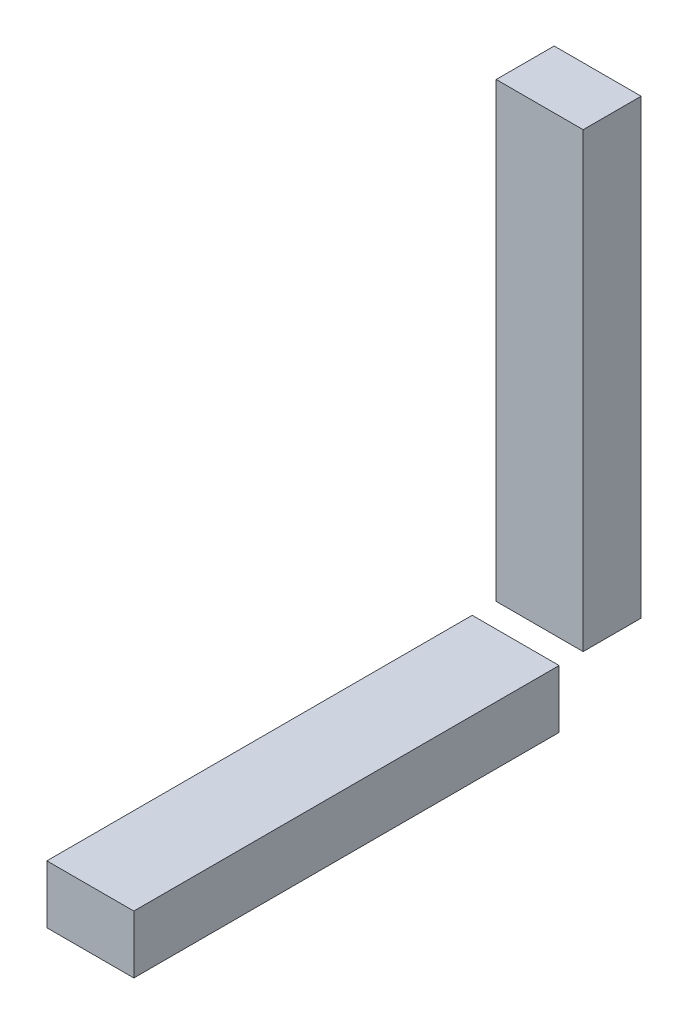
from build123d import *

# Parameters (mm, degrees)
SKETCH11_W          = 30
SKETCH11_H          = 155.928336779
BOSS_EXTRUDE2_DEPTH = 20
SKETCH16_W          = 146.715728753
SKETCH16_H          = 20
BOSS_EXTRUDE3_DEPTH = 15


with BuildPart() as part:
    # Sketch11 → Boss-Extrude2 (new body)
    with BuildSketch(Plane.XY):
        with Locations((0, -124.300831611)):
            Rectangle(SKETCH11_W, SKETCH11_H)
    extrude(amount=-BOSS_EXTRUDE2_DEPTH)


with BuildPart() as body_2:
    # Sketch16 → Boss-Extrude3 (new, symmetric)
    with BuildSketch(Plane(origin=(0, 0, 0), x_dir=(0, 0, -1), z_dir=(1, 0, 0))):
        with Locations((-81.642135623, -212.265)):
            Rectangle(SKETCH16_W, SKETCH16_H)
    extrude(amount=BOSS_EXTRUDE3_DEPTH, both=True)


solid = Compound([part.part, body_2.part])
